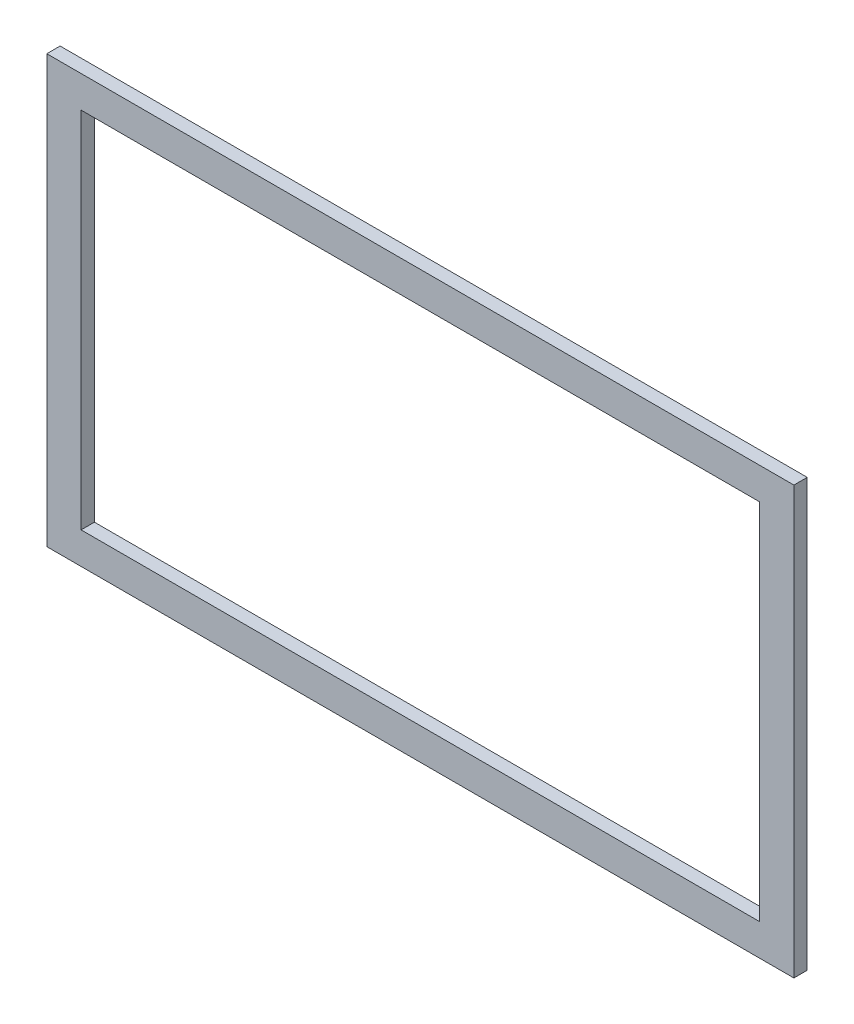
from build123d import *

# Parameters (mm, degrees)
CROQUIS1_W              = 28
CROQUIS1_H              = 16
SALIENTE_EXTRUIR2_DEPTH = 0.5
CROQUIS3_W              = 25.426606922
CROQUIS3_H              = 13.62465138
CORTAR_EXTRUIR2_DEPTH   = 17.132265805


with BuildPart() as part:
    # Croquis1 → Saliente-Extruir2 (new body)
    with BuildSketch(Plane.XY):
        Rectangle(CROQUIS1_W, CROQUIS1_H)
    extrude(amount=SALIENTE_EXTRUIR2_DEPTH)

    # Croquis3 → Cortar-Extruir2 (cut, through all)
    with BuildSketch(Plane.XY.offset(0.5)):
        Rectangle(CROQUIS3_W, CROQUIS3_H)
    extrude(amount=-CORTAR_EXTRUIR2_DEPTH, mode=Mode.SUBTRACT)


solid = part.part
